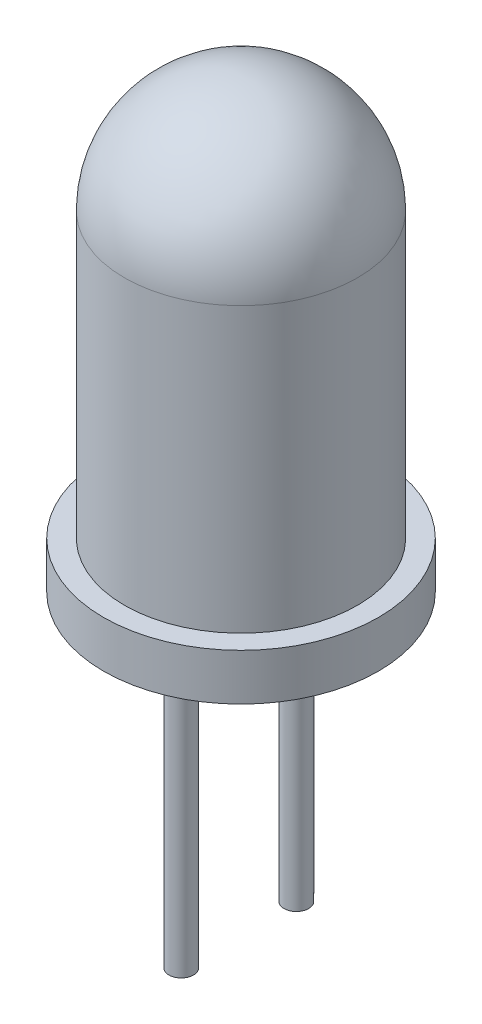
from build123d import *

# Parameters (mm, degrees)
SKETCH2_R           = 0.26475865
BOSS_EXTRUDE1_DEPTH = 6.35


with BuildPart() as part:
    # Sketch1 → Revolve6 (revolve)
    with BuildSketch(Plane(origin=(0, 0, 0), x_dir=(0, 0, -1), z_dir=(1, 0, 0)), mode=Mode.PRIVATE) as revolve6_sk:
        with BuildLine():
            ThreePointArc((2.5, 0), (1.767766953, 1.767766953), (0, 2.5))
            Line((0, 2.5), (0, -7.09))
            Line((0, -7.09), (2.95, -7.09))
            Line((2.95, -7.09), (2.95, -6.09))
            Line((2.95, -6.09), (2.5, -6.09))
            Line((2.5, -6.09), (2.5, 0))
        make_face()
    revolve(revolve6_sk.sketch.rotate(Axis((0, 2.5, 0), (0, -1, 0)), 180), axis=Axis((0, 2.5, 0), (0, -1, 0)))

    # Sketch2 → Boss-Extrude1 (add)
    with BuildSketch(Plane.XZ.offset(7.09)):
        with Locations(Location((0, 1.283330706, 0), (0, 0, 90))):
            Circle(SKETCH2_R)
        with Locations(Location((0, -1.188269173, 0), (0, 0, 90))):
            Circle(SKETCH2_R)
    extrude(amount=BOSS_EXTRUDE1_DEPTH)


solid = part.part
